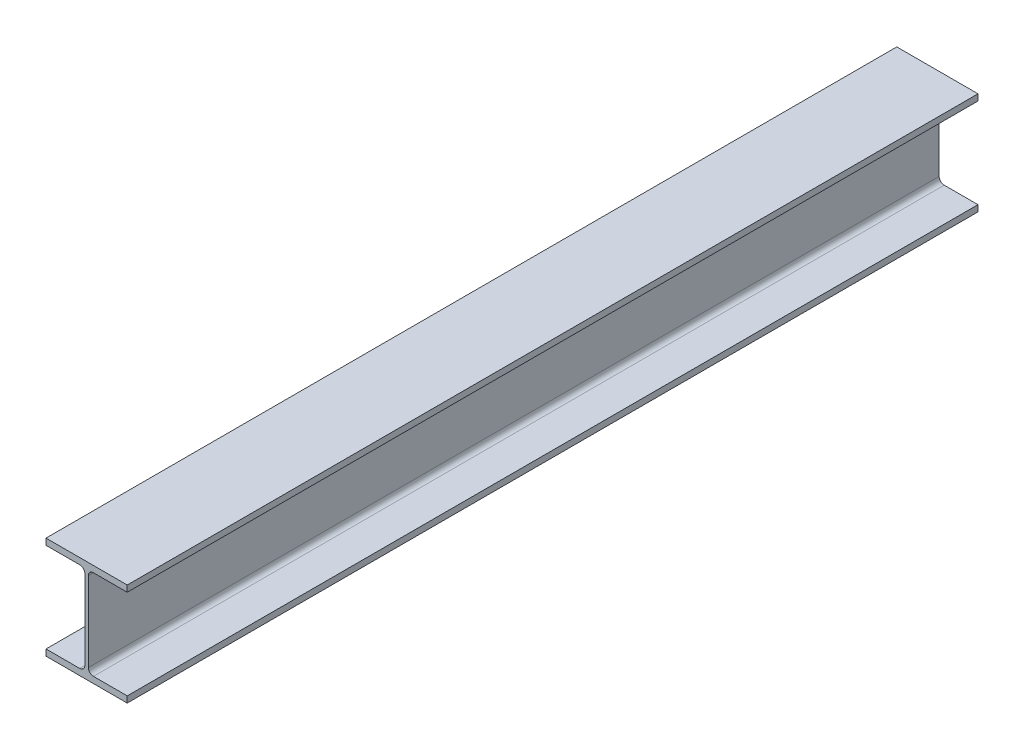
from build123d import *

# Parameters (mm, degrees)
BASESTEELW_DEPTH = 1066.8


with BuildPart() as part:
    # Sketch1 → BaseSteelW (new, symmetric)
    with BuildSketch(Plane.XY):
        with BuildLine():
            Line((0, 0), (0, 15.748))
            Line((0, 15.748), (84.709, 15.748))
            ThreePointArc((84.709, 15.748), (93.689256121, 19.467743879), (97.409, 28.448))
            Line((97.409, 28.448), (97.409, 228.092))
            ThreePointArc((97.409, 228.092), (93.689256121, 237.072256121), (84.709, 240.792))
            Line((84.709, 240.792), (0, 240.792))
            Line((0, 240.792), (0, 256.54))
            Line((0, 256.54), (203.708, 256.54))
            Line((203.708, 256.54), (203.708, 240.792))
            Line((203.708, 240.792), (118.999, 240.792))
            ThreePointArc((118.999, 240.792), (110.018743879, 237.072256121), (106.299, 228.092))
            Line((106.299, 228.092), (106.299, 28.448))
            ThreePointArc((106.299, 28.448), (110.018743879, 19.467743879), (118.999, 15.748))
            Line((118.999, 15.748), (203.708, 15.748))
            Line((203.708, 15.748), (203.708, 0))
            Line((203.708, 0), (0, 0))
        make_face()
    extrude(amount=BASESTEELW_DEPTH, both=True)


solid = part.part
